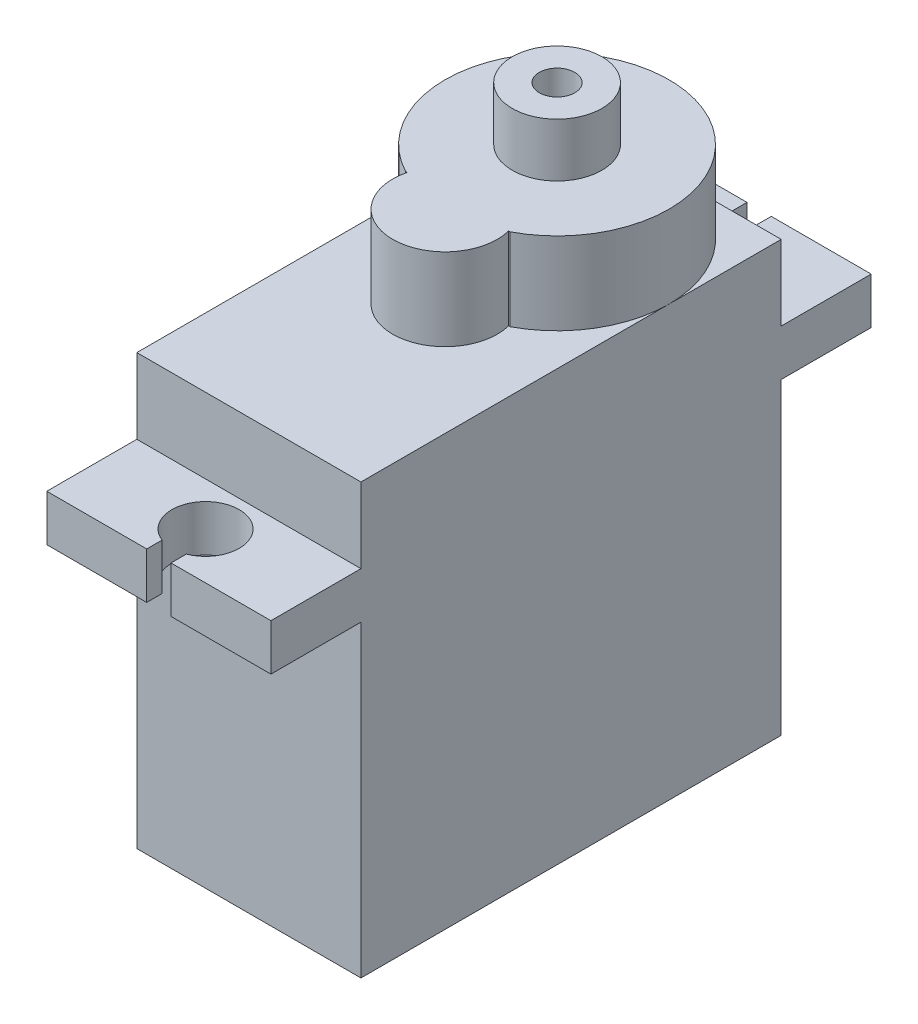
from build123d import *

# Parameters (mm, degrees)
SKETCH2_W            = 22.5
SKETCH2_H            = 23
BOSS_EXTRUDE1_DEPTH  = 12
SKETCH19_W           = 12
SKETCH19_H           = 2.48
BOSS_EXTRUDE8_DEPTH  = 4.82
SKETCH20_W           = 12
SKETCH20_H           = 2.48
BOSS_EXTRUDE9_DEPTH  = 4.82
SKETCH21_R           = 2.4
BOSS_EXTRUDE10_DEPTH = 4.4
SKETCH21_3_R         = 2.4
SKETCH21_3_R_2       = 0.95
BOSS_EXTRUDE11_DEPTH = 7.27
CUT_EXTRUDE5_DEPTH   = 2.49


with BuildPart() as part:
    # Sketch2 → Boss-Extrude1 (new body)
    with BuildSketch(Plane(origin=(0, 0, 0), x_dir=(0, 0, -1), z_dir=(1, 0, 0))):
        Rectangle(SKETCH2_W, SKETCH2_H)
    extrude(amount=BOSS_EXTRUDE1_DEPTH)

    # Sketch19 → Boss-Extrude8 (add)
    with BuildSketch(Plane.XY.offset(11.25)):
        with Locations((6, 6.24)):
            Rectangle(SKETCH19_W, SKETCH19_H)
    extrude(amount=BOSS_EXTRUDE8_DEPTH)

    # Sketch20 → Boss-Extrude9 (add)
    with BuildSketch(Plane(origin=(0, 0, -11.25), x_dir=(-1, 0, 0), z_dir=(0, 0, -1))):
        with Locations((-6, 6.24)):
            Rectangle(SKETCH20_W, SKETCH20_H)
    extrude(amount=BOSS_EXTRUDE9_DEPTH)

    # Sketch21 → Boss-Extrude10 (add)
    # profile 1 of 6: a face of its own
    with BuildSketch(Plane(origin=(0, 11.5, 0), x_dir=(1, 0, 0), z_dir=(0, 1, 0))):
        with BuildLine():
            ThreePointArc((6, 11.25), (1.757359316, 9.49264069), (0, 5.250000008))
            ThreePointArc((0, 5.250000008), (0.861906966, 2.151613326), (3.2, -0.056599665))
            Line((3.2, -0.056599665), (3.287216195, -0.056599665))
            ThreePointArc((3.287216195, -0.056599665), (6, 2.05), (8.712783805, -0.056599665))
            Line((8.712783805, -0.056599665), (8.8, -0.056599665))
            ThreePointArc((8.8, -0.056599665), (11.138093031, 2.151613323), (12, 5.25))
            ThreePointArc((12, 5.25), (10.242640687, 9.492640687), (6, 11.25))
        make_face()
        with Locations(Location((6, 5.25, 0), (0, 0, 90))):
            Circle(SKETCH21_R, mode=Mode.SUBTRACT)
    # profile 2 of 6: a face of its own
    with BuildSketch(Plane(origin=(0, 11.5, 0), x_dir=(1, 0, 0), z_dir=(0, 1, 0))):
        with BuildLine():
            Line((6, -0.75), (8.8, -0.75))
            ThreePointArc((8.8, -0.75), (8.780610633, -0.421055467), (8.722711067, -0.096666667))
            ThreePointArc((8.722711067, -0.096666667), (7.4, -0.584380858), (6, -0.75))
        make_face()
    # profile 3 of 6: a face of its own
    with BuildSketch(Plane(origin=(0, 11.5, 0), x_dir=(1, 0, 0), z_dir=(0, 1, 0))):
        with BuildLine():
            ThreePointArc((3.277288933, -0.096666667), (3.219389367, -0.421055467), (3.2, -0.75))
            Line((3.2, -0.75), (6, -0.75))
            ThreePointArc((6, -0.75), (4.6, -0.584380858), (3.277288933, -0.096666667))
        make_face()
    # profile 4 of 6: a face of its own
    with BuildSketch(Plane(origin=(0, 11.5, 0), x_dir=(1, 0, 0), z_dir=(0, 1, 0))):
        with BuildLine():
            ThreePointArc((3.2, -0.75), (4.020101013, -2.729898987), (6, -3.55))
            ThreePointArc((6, -3.55), (7.979898987, -2.729898987), (8.8, -0.75))
            Line((8.8, -0.75), (6, -0.75))
            Line((6, -0.75), (3.2, -0.75))
        make_face()
    # profile 5 of 6: a face of its own
    with BuildSketch(Plane(origin=(0, 11.5, 0), x_dir=(1, 0, 0), z_dir=(0, 1, 0))):
        with BuildLine():
            ThreePointArc((8.712783805, -0.056599665), (6, 2.05), (3.287216195, -0.056599665))
            Line((3.287216195, -0.056599665), (8.712783805, -0.056599665))
        make_face()
    # profile 6 of 6: a face of its own
    with BuildSketch(Plane(origin=(0, 11.5, 0), x_dir=(1, 0, 0), z_dir=(0, 1, 0))):
        with BuildLine():
            ThreePointArc((3.277288933, -0.096666667), (4.6, -0.584380858), (6, -0.75))
            ThreePointArc((6, -0.75), (7.4, -0.584380858), (8.722711067, -0.096666667))
            ThreePointArc((8.722711067, -0.096666667), (8.717821272, -0.076614872), (8.712783805, -0.056599665))
            Line((8.712783805, -0.056599665), (3.287216195, -0.056599665))
            ThreePointArc((3.287216195, -0.056599665), (3.282178728, -0.076614872), (3.277288933, -0.096666667))
        make_face()
    extrude(amount=BOSS_EXTRUDE10_DEPTH)

    # Sketch21<3> → Boss-Extrude11 (add)
    with BuildSketch(Plane(origin=(0, 11.5, 0), x_dir=(1, 0, 0), z_dir=(0, 1, 0))):
        with Locations(Location((6, 5.25, 0), (0, 0, 90))):
            Circle(SKETCH21_3_R)
        with Locations(Location((6, 5.25, 0), (0, 0, 90))):
            Circle(SKETCH21_3_R_2, mode=Mode.SUBTRACT)
    extrude(amount=BOSS_EXTRUDE11_DEPTH)

    # Sketch23 → Cut-Extrude5 (cut)
    with BuildSketch(Plane(origin=(0, 7.48, 0), x_dir=(1, 0, 0), z_dir=(0, 1, 0))):
        with BuildLine():
            Line((6.65, -15.248541033), (6.65, -16.07))
            Line((6.65, -16.07), (5.35, -16.07))
            Line((5.35, -16.07), (5.35, -15.248541033))
            ThreePointArc((5.35, -15.248541033), (6, -11.77), (6.65, -15.248541033))
        make_face()
    cut_extrude5 = extrude(amount=-CUT_EXTRUDE5_DEPTH, mode=Mode.SUBTRACT)

    # Mirror3: Cut-Extrude5 across plane
    add(cut_extrude5.mirror(Plane.XY), mode=Mode.SUBTRACT)


solid = part.part
